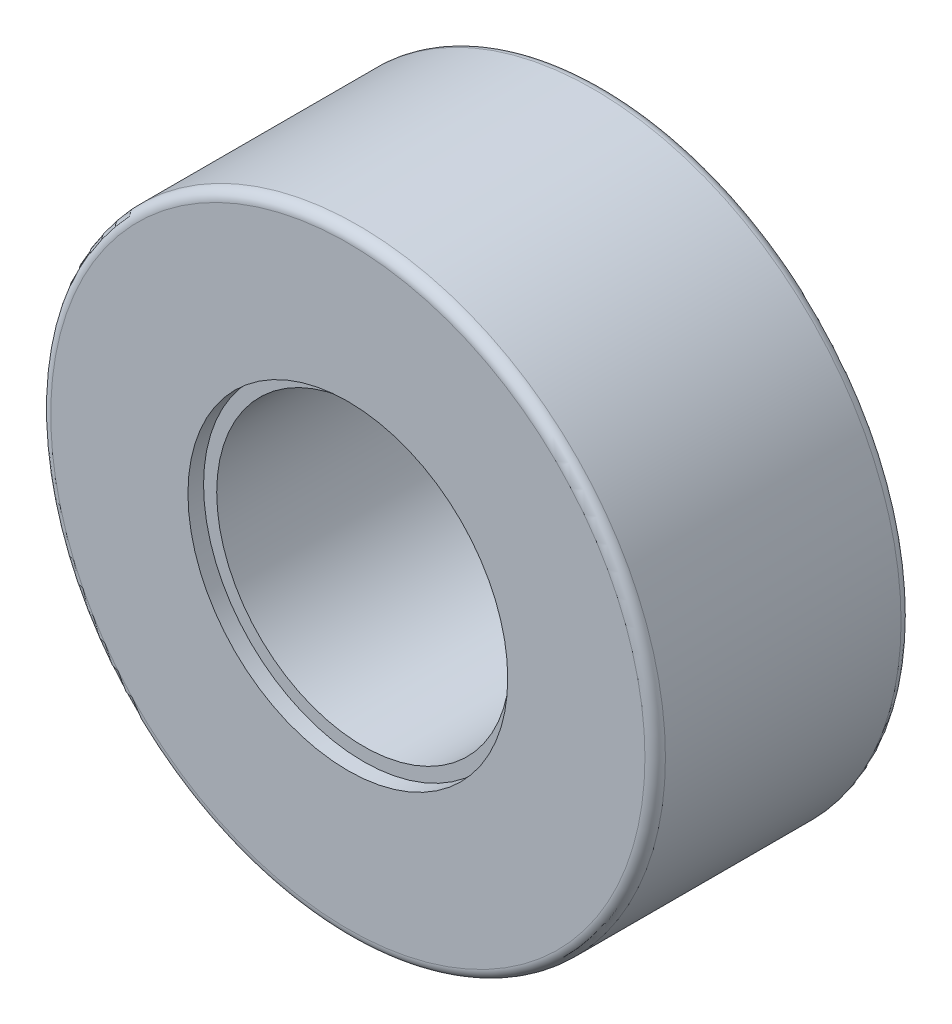
from build123d import *

# Parameters (mm, degrees)
SKETCH1_R           = 30
SKETCH1_R_2         = 14.325
BOSS_EXTRUDE1_DEPTH = 12.5
SKETCH3_R           = 15.6075
CUT_EXTRUDE1_DEPTH  = 1.524
FILLET1_R           = 1


with BuildPart() as part:
    # Sketch1 → Boss-Extrude1 (new, symmetric)
    with BuildSketch(Plane.XY):
        Circle(SKETCH1_R)
        Circle(SKETCH1_R_2, mode=Mode.SUBTRACT)
    extrude(amount=BOSS_EXTRUDE1_DEPTH, both=True)

    # Sketch3 → Cut-Extrude1 (cut)
    with BuildSketch(Plane.XY.offset(12.5)):
        Circle(SKETCH3_R)
    cut_extrude1 = extrude(amount=-CUT_EXTRUDE1_DEPTH, mode=Mode.SUBTRACT)

    # Mirror1: Cut-Extrude1 across plane
    add(cut_extrude1.mirror(Plane.XY), mode=Mode.SUBTRACT)

    # Fillet1
    fillet1_edges = [part.edges().sort_by_distance(p)[0] for p in [
        (-30, 0, -12.5),
        (-30, 0, 12.5),
    ]]
    fillet(fillet1_edges, radius=FILLET1_R)


solid = part.part
